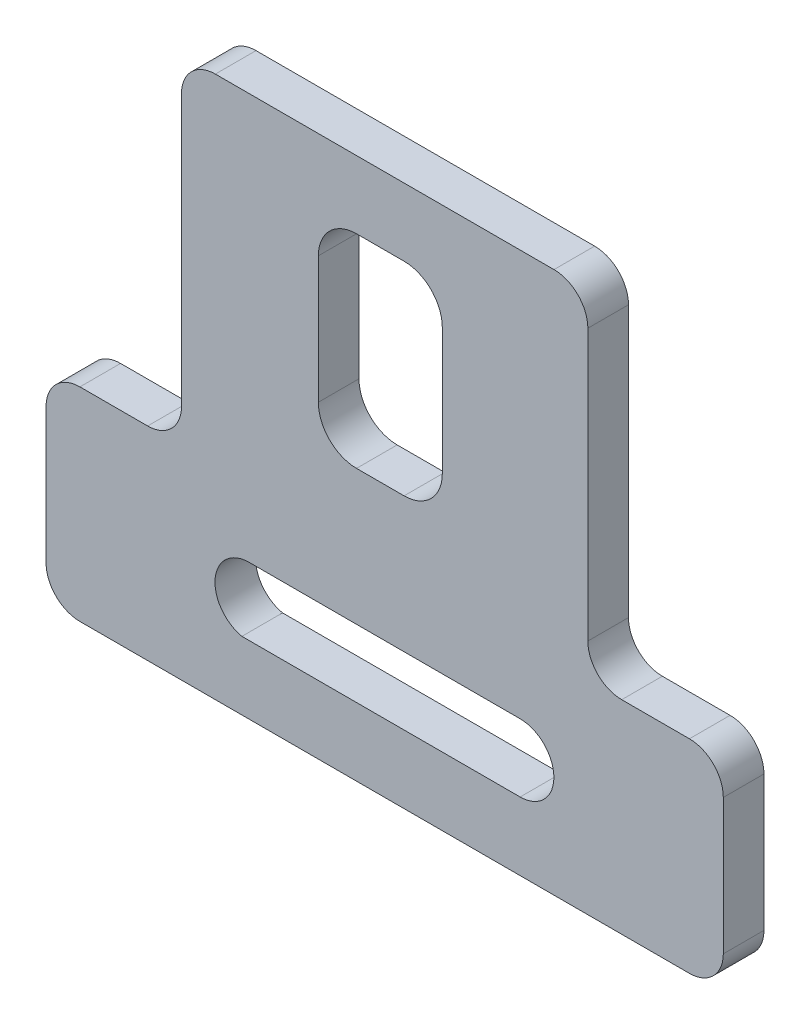
from build123d import *

# Parameters (mm, degrees)
BOSS_EXTRUDE1_DEPTH = 30


with BuildPart() as part:
    # Sketch1 → Boss-Extrude1 (new body)
    with BuildSketch(Plane.XY):
        with BuildLine():
            Line((-175, -125), (-225, -125))
            ThreePointArc((-225, -125), (-242.67766953, -132.32233047), (-250, -150))
            Line((-250, -150), (-250, -250))
            ThreePointArc((-250, -250), (-242.67766953, -267.67766953), (-225, -275))
            Line((-225, -275), (225, -275))
            ThreePointArc((225, -275), (242.67766953, -267.67766953), (250, -250))
            Line((250, -250), (250, -150))
            ThreePointArc((250, -150), (242.67766953, -132.32233047), (225, -125))
            Line((225, -125), (175, -125))
            ThreePointArc((175, -125), (157.32233047, -117.67766953), (150, -100))
            Line((150, -100), (150, 100))
            ThreePointArc((150, 100), (142.67766953, 117.67766953), (125, 125))
            Line((125, 125), (-125, 125))
            ThreePointArc((-125, 125), (-142.67766953, 117.67766953), (-150, 100))
            Line((-150, 100), (-150, -100))
            ThreePointArc((-150, -100), (-157.32233047, -117.67766953), (-175, -125))
        make_face()
        with BuildLine():
            Line((-20.785894669, 75), (14.336083622, 75))
            ThreePointArc((14.336083622, 75), (34.268791925, 66.743601886), (42.525190039, 46.810893583))
            Line((42.525190039, 46.810893583), (42.525190039, -46.810893583))
            ThreePointArc((42.525190039, -46.810893583), (34.268791925, -66.743601886), (14.336083622, -75))
            Line((14.336083622, -75), (-20.785894669, -75))
            ThreePointArc((-20.785894669, -75), (-40.718602973, -66.743601886), (-48.975001087, -46.810893583))
            Line((-48.975001087, -46.810893583), (-48.975001087, 46.810893583))
            ThreePointArc((-48.975001087, 46.810893583), (-40.718602973, 66.743601886), (-20.785894669, 75))
        make_face(mode=Mode.SUBTRACT)
        with BuildLine():
            Line((-100.16408543, -174.707408676), (99.83591457, -174.707408676))
            ThreePointArc((99.83591457, -174.707408676), (124.917346487, -199.625710645), (99.999044519, -224.707142562))
            Line((99.999044519, -224.707142562), (-105.412874128, -224.707142562))
            ThreePointArc((-105.412874128, -224.707142562), (-125.154899456, -197.359330907), (-100.16408543, -174.707408676))
        make_face(mode=Mode.SUBTRACT)
    extrude(amount=BOSS_EXTRUDE1_DEPTH)


solid = part.part
